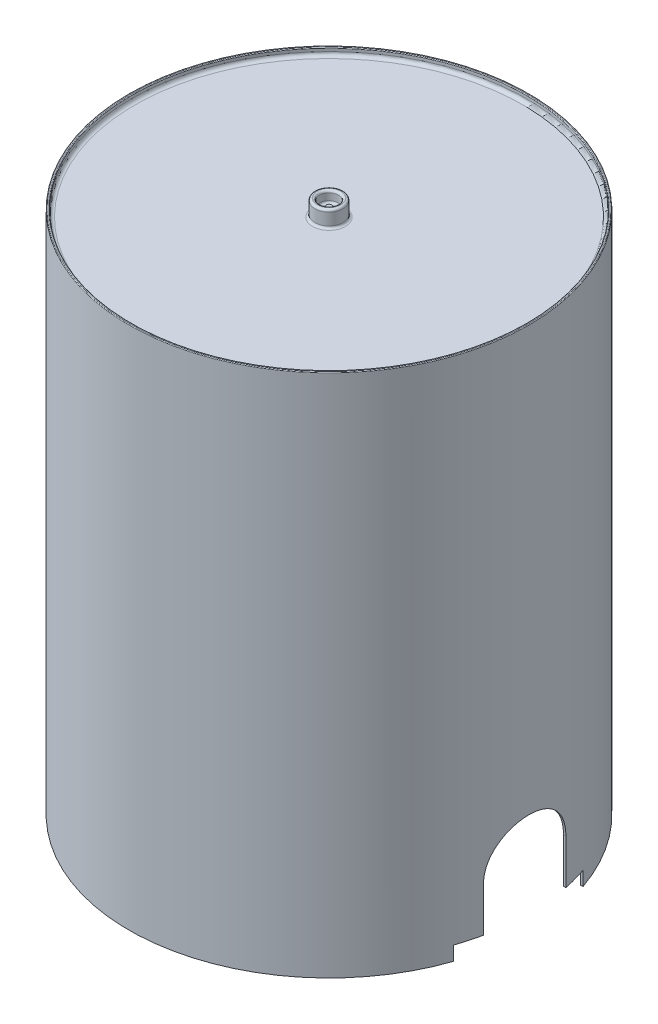
from build123d import *

# Parameters (mm, degrees)
ENL_V_MAT_EXTRU_2_DEPTH      = 257.86377716
ENL_V_MAT_EXTRU_2_DEPTH_BACK = 257.86377716


with BuildPart() as part:
    # Esquisse2 → Révolution1 (revolve)
    with BuildSketch(Plane.XY):
        with BuildLine():
            Line((0, 220), (0, 219))
            Line((0, 219), (79, 219))
            ThreePointArc((79, 219), (82.535533906, 217.535533906), (84, 214))
            Line((84, 214), (84, 0))
            Line((84, 0), (85, 0))
            Line((85, 0), (85, 220))
            Line((85, 220), (85, 222.7))
            ThreePointArc((85, 222.7), (84.912132034, 222.912132034), (84.7, 223))
            Line((84.7, 223), (84.3, 223))
            ThreePointArc((84.3, 223), (84.087867966, 222.912132034), (84, 222.7))
            Line((84, 222.7), (84, 221.5))
            ThreePointArc((84, 221.5), (83.560660172, 220.439339828), (82.5, 220))
            Line((82.5, 220), (6.95, 220))
            ThreePointArc((6.95, 220), (6.278248558, 220.278248558), (6, 220.95))
            Line((6, 220.95), (6, 226.05))
            ThreePointArc((6, 226.05), (5.721751442, 226.721751442), (5.05, 227))
            Line((5.05, 227), (4.95, 227))
            ThreePointArc((4.95, 227), (4.278248558, 226.721751442), (4, 226.05))
            Line((4, 226.05), (4, 223.19410066))
            ThreePointArc((4, 223.19410066), (3.721751442, 222.522349218), (3.05, 222.24410066))
            Line((3.05, 222.24410066), (1.95, 222.24410066))
            ThreePointArc((1.95, 222.24410066), (1.278248558, 222.522349218), (1, 223.19410066))
            Line((1, 223.19410066), (1, 224))
            Line((1, 224), (0, 224))
            Line((0, 224), (0, 220))
        make_face()
    revolve(axis=Axis((0, 0, 0), (0, 1, 0)))

    # Esquisse3 → Enlèv. mat.-Extru.2 (cut, two sides: drawn at the far end of the back side and taken through both)
    with BuildSketch(Plane(origin=(0, 0, 0), x_dir=(0, 0, -1), z_dir=(1, 0, 0)).offset(-ENL_V_MAT_EXTRU_2_DEPTH_BACK)):
        with BuildLine():
            Line((-17.5, 25), (-17.5, 6))
            Line((-17.5, 6), (-27.5, 6))
            Line((-27.5, 6), (-27.5, 0))
            Line((-27.5, 0), (27.5, 0))
            Line((27.5, 0), (27.5, 6))
            Line((27.5, 6), (17.5, 6))
            Line((17.5, 6), (17.5, 25))
            ThreePointArc((17.5, 25), (0, 42.5), (-17.5, 25))
        make_face()
    extrude(amount=ENL_V_MAT_EXTRU_2_DEPTH + ENL_V_MAT_EXTRU_2_DEPTH_BACK, mode=Mode.SUBTRACT)


solid = part.part
